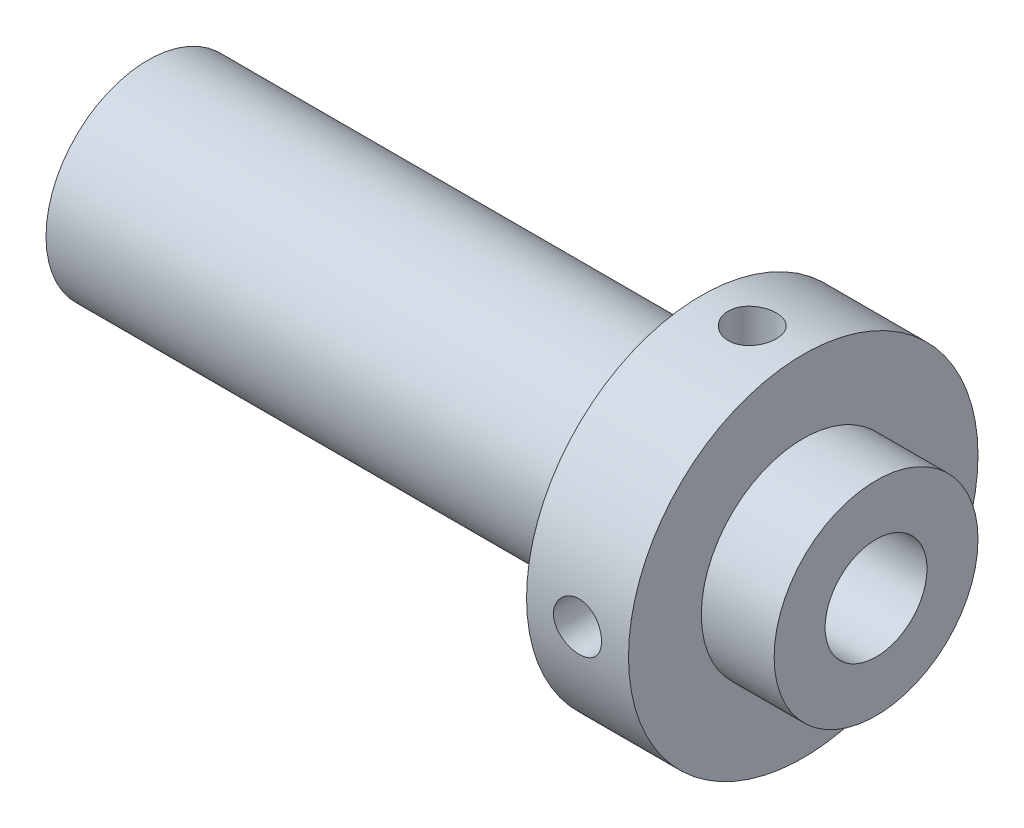
from build123d import *

# Parameters (mm, degrees)
TROU_TARAUD_M8X1_01_D     = 7
TROU_TARAUD_M8X1_01_DEPTH = 30
TROU_TARAUD_M8X1_01_TIP   = 2.103012167
TROU_TARAUD_M41_REACH     = 58.745
TROU_TARAUD_M41_BORE_R    = 1.65
TROU_TARAUD_M42_REACH     = 58.745
TROU_TARAUD_M42_BORE_R    = 1.65


with BuildPart() as part:
    # Sketch1 → Revolve1 (revolve)
    with BuildSketch(Plane.XY, mode=Mode.PRIVATE) as revolve1_sk:
        Polygon((-5, 12), (-5, 7), (0, 7), (0, 0), (-50, 0), (-50, 7), (-12, 7), (-12, 12), align=None)
    revolve(revolve1_sk.sketch.rotate(Axis((-78.343949045, 0, 0), (1, 0, 0)), 90), axis=Axis((-78.343949045, 0, 0), (1, 0, 0)))

    # Trou taraudé M8x1.01
    with Locations(Plane(origin=(0, 0, 0), x_dir=(0, 0, -1), z_dir=(1, 0, 0))):
        with Locations((0, 0)):
            Hole(TROU_TARAUD_M8X1_01_D / 2, depth=TROU_TARAUD_M8X1_01_DEPTH)
            with Locations((0, 0, -(TROU_TARAUD_M8X1_01_DEPTH + TROU_TARAUD_M8X1_01_TIP / 2))):  # 118° drill point
                Cone(0, TROU_TARAUD_M8X1_01_D / 2, TROU_TARAUD_M8X1_01_TIP, mode=Mode.SUBTRACT)

    # Trou taraudé M41 bore → Trou taraudé M41 (cut, up to next)
    with BuildSketch(Plane.XY.offset(12), mode=Mode.PRIVATE) as trou_taraud_m41_sk1:
        with Locations((-8.5, 0)):
            Circle(TROU_TARAUD_M41_BORE_R)
    trou_taraud_m41_tool1 = extrude(trou_taraud_m41_sk1.sketch, amount=-TROU_TARAUD_M41_REACH, mode=Mode.PRIVATE) & part.part
    add(trou_taraud_m41_tool1.solids().sort_by_distance((-8.5, 0, 12))[0], mode=Mode.SUBTRACT)

    # Trou taraudé M42 bore → Trou taraudé M42 (cut, up to next)
    with BuildSketch(Plane(origin=(0, 12, 0), x_dir=(1, 0, 0), z_dir=(0, 1, 0)), mode=Mode.PRIVATE) as trou_taraud_m42_sk1:
        with Locations((-8.5, 0)):
            Circle(TROU_TARAUD_M42_BORE_R)
    trou_taraud_m42_tool1 = extrude(trou_taraud_m42_sk1.sketch, amount=-TROU_TARAUD_M42_REACH, mode=Mode.PRIVATE) & part.part
    add(trou_taraud_m42_tool1.solids().sort_by_distance((-8.5, 12, 0))[0], mode=Mode.SUBTRACT)


solid = part.part
